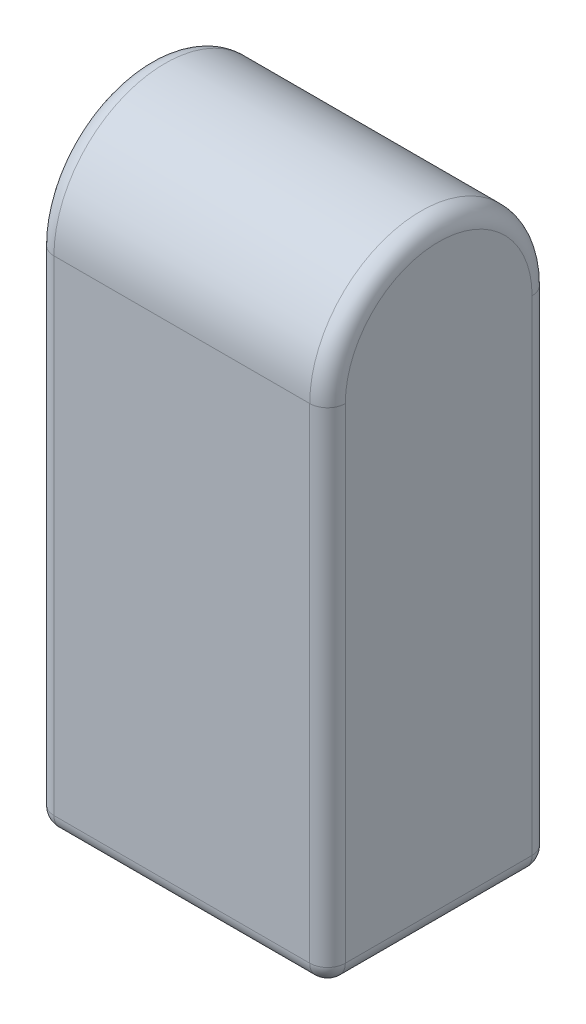
from build123d import *

# Parameters (mm, degrees)
BOSS_EXTRUDE1_DEPTH = 16.383
FILLET1_R           = 2


with BuildPart() as part:
    # Sketch1 → Boss-Extrude1 (new, symmetric)
    with BuildSketch(Plane(origin=(0, 0, 0), x_dir=(0, 0, -1), z_dir=(1, 0, 0))):
        with BuildLine():
            Line((-12.5, 56.5), (-12.5, 0))
            Line((-12.5, 0), (12.5, 0))
            Line((12.5, 0), (12.5, 56.5))
            ThreePointArc((12.5, 56.5), (0, 69), (-12.5, 56.5))
        make_face()
    extrude(amount=BOSS_EXTRUDE1_DEPTH, both=True)

    # Fillet1
    fillet1_edges = [part.edges().sort_by_distance(p)[0] for p in [
        (16.383, 0, 0),
        (16.383, 28.25, -12.5),
        (16.383, 69, 0),
        (-16.383, 28.25, -12.5),
        (-16.383, 0, 0),
        (-16.383, 28.25, 12.5),
        (-16.383, 69, 0),
        (0, 0, -12.5),
        (0, 0, 12.5),
        (16.383, 28.25, 12.5),
    ]]
    fillet(fillet1_edges, radius=FILLET1_R)


solid = part.part
